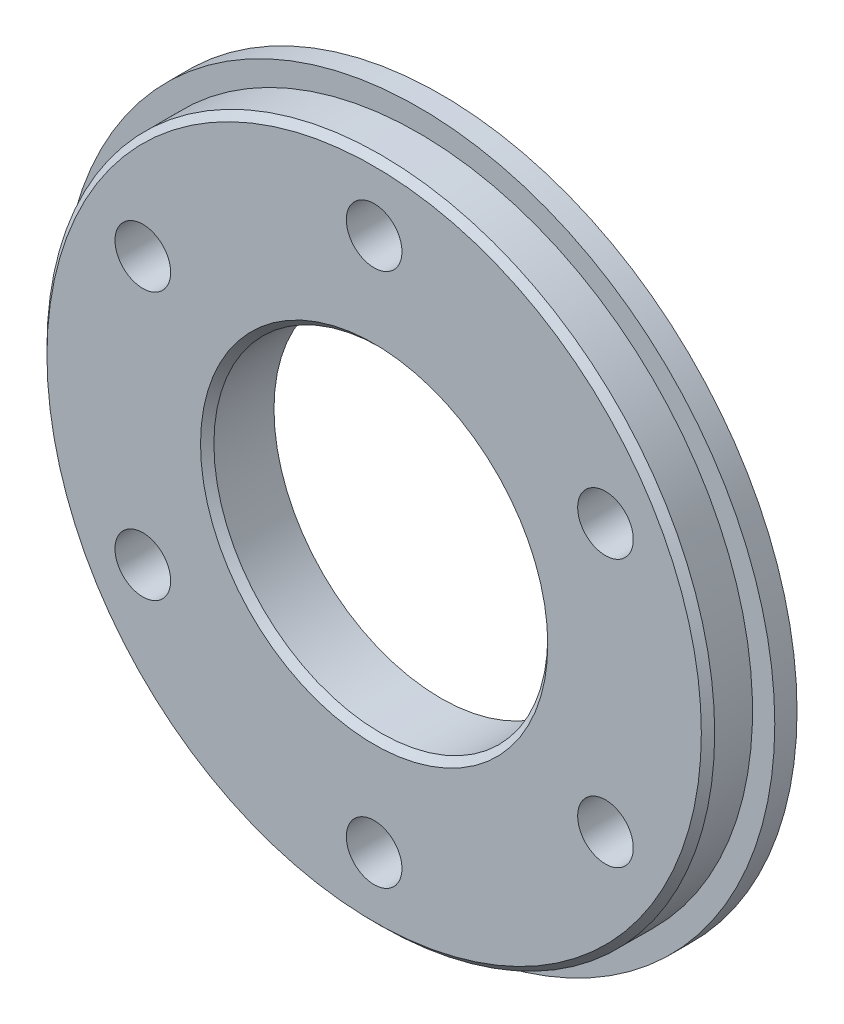
from build123d import *

# Parameters (mm, degrees)
SKETCH_1_R          = 15
EXTRUDE_5_DEPTH     = 3
SKETCH_8_R          = 16
EXTRUDE_7_DEPTH     = 1
SKETCH_9_R          = 7.5
CUT_EXTRUDE_3_DEPTH = 9
HOLE_WIZARD_M3_1_D  = 2.5
CHAMFER_1_SIZE      = 0.3
CHAMFER_2_SIZE      = 0.3


with BuildPart() as part:
    # 草图1 → 凸台-拉伸5 (new body)
    with BuildSketch(Plane.XY):
        Circle(SKETCH_1_R)
    extrude(amount=EXTRUDE_5_DEPTH)

    # 草图8 → 凸台-拉伸7 (add)
    with BuildSketch(Plane(origin=(0, 0, 0), x_dir=(-1, 0, 0), z_dir=(0, 0, -1))):
        Circle(SKETCH_8_R)
    extrude(amount=-EXTRUDE_7_DEPTH)

    # 草图9 → 切除-拉伸3 (cut)
    with BuildSketch(Plane(origin=(0, 0, 0), x_dir=(-1, 0, 0), z_dir=(0, 0, -1))):
        Circle(SKETCH_9_R)
    extrude(amount=-CUT_EXTRUDE_3_DEPTH, mode=Mode.SUBTRACT)

    # M3 螺纹孔1 (through all)
    with Locations(Plane(origin=(0, 0, 0), x_dir=(-1, 0, 0), z_dir=(0, 0, -1))):
        with Locations((0, 0), (0, 12), (10.392304845, 6), (10.392304845, -6), (0, -12), (-10.392304845, -6), (-10.392304845, 6)):
            Hole(HOLE_WIZARD_M3_1_D / 2)

    # 倒角1
    chamfer_1_edges = [part.edges().sort_by_distance(p)[0] for p in [
        (-15, 0, 3),
    ]]
    chamfer(chamfer_1_edges, length=CHAMFER_1_SIZE)

    # 倒角2
    chamfer_2_edges = [part.edges().sort_by_distance(p)[0] for p in [
        (7.5, 0, 3),
    ]]
    chamfer(chamfer_2_edges, length=CHAMFER_2_SIZE)


solid = part.part
